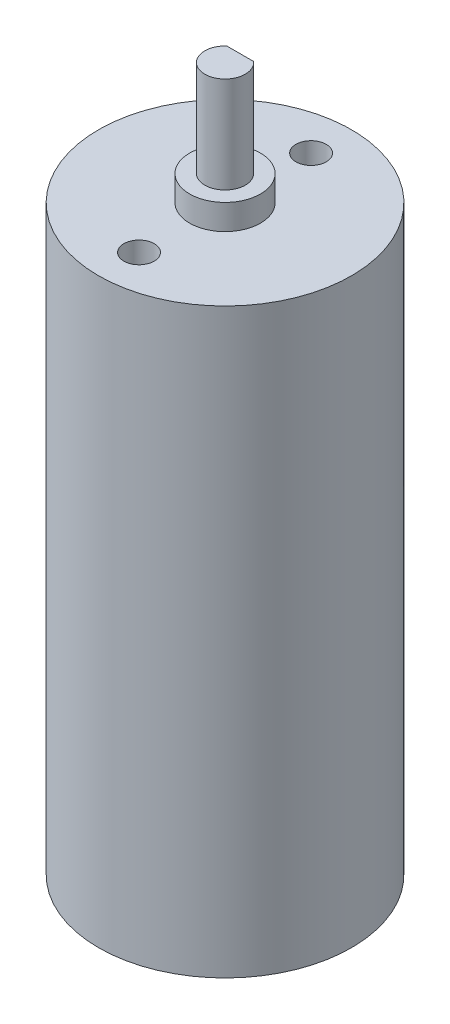
from build123d import *

# Parameters (mm, degrees)
SKETCH_1_R          = 12.5
EXTRUDE_1_DEPTH     = 57.5
SKETCH_2_R          = 3.5
EXTRUDE_2_DEPTH     = 2.5
SKETCH_3_R          = 2
EXTRUDE_3_DEPTH     = 9.5
CUT_EXTRUDE_1_DEPTH = 8
SKETCH_5_R          = 1.5
CUT_EXTRUDE_2_DEPTH = 5


with BuildPart() as part:
    # 草图1 → 凸台-拉伸1 (new body)
    with BuildSketch(Plane(origin=(0, 0, 0), x_dir=(1, 0, 0), z_dir=(0, 1, 0))):
        with Locations(Location((0, 0, 0), (0, 0, 270))):
            Circle(SKETCH_1_R)
    extrude(amount=EXTRUDE_1_DEPTH)

    # 草图2 → 凸台-拉伸2 (add)
    with BuildSketch(Plane(origin=(0, 57.5, 0), x_dir=(1, 0, 0), z_dir=(0, 1, 0))):
        with Locations(Location((0, 0, 0), (0, 0, 270))):
            Circle(SKETCH_2_R)
    extrude(amount=EXTRUDE_2_DEPTH)

    # 草图3 → 凸台-拉伸3 (add)
    with BuildSketch(Plane(origin=(0, 60, 0), x_dir=(1, 0, 0), z_dir=(0, 1, 0))):
        with Locations(Location((0, 0, 0), (0, 0, 270))):
            Circle(SKETCH_3_R)
    extrude(amount=EXTRUDE_3_DEPTH)

    # 草图4 → 切除-拉伸1 (cut)
    with BuildSketch(Plane(origin=(0, 69.5, 0), x_dir=(1, 0, 0), z_dir=(0, 1, 0))):
        Polygon((-50.671161076, 1.5), (-1.322875656, 1.5), (1.322875656, 1.5), (50.671161076, 1.5), (50.671161076, 100.196570842), (-50.671161076, 100.196570842), align=None)
    extrude(amount=-CUT_EXTRUDE_1_DEPTH, mode=Mode.SUBTRACT)

    # 草图5 → 切除-拉伸2 (cut)
    with BuildSketch(Plane(origin=(0, 57.5, 0), x_dir=(1, 0, 0), z_dir=(0, 1, 0))):
        with Locations(Location((0, 8.5, 0), (0, 0, 270))):
            Circle(SKETCH_5_R)
        with Locations(Location((0, -8.5, 0), (0, 0, 270))):
            Circle(SKETCH_5_R)
    extrude(amount=-CUT_EXTRUDE_2_DEPTH, mode=Mode.SUBTRACT)


solid = part.part
